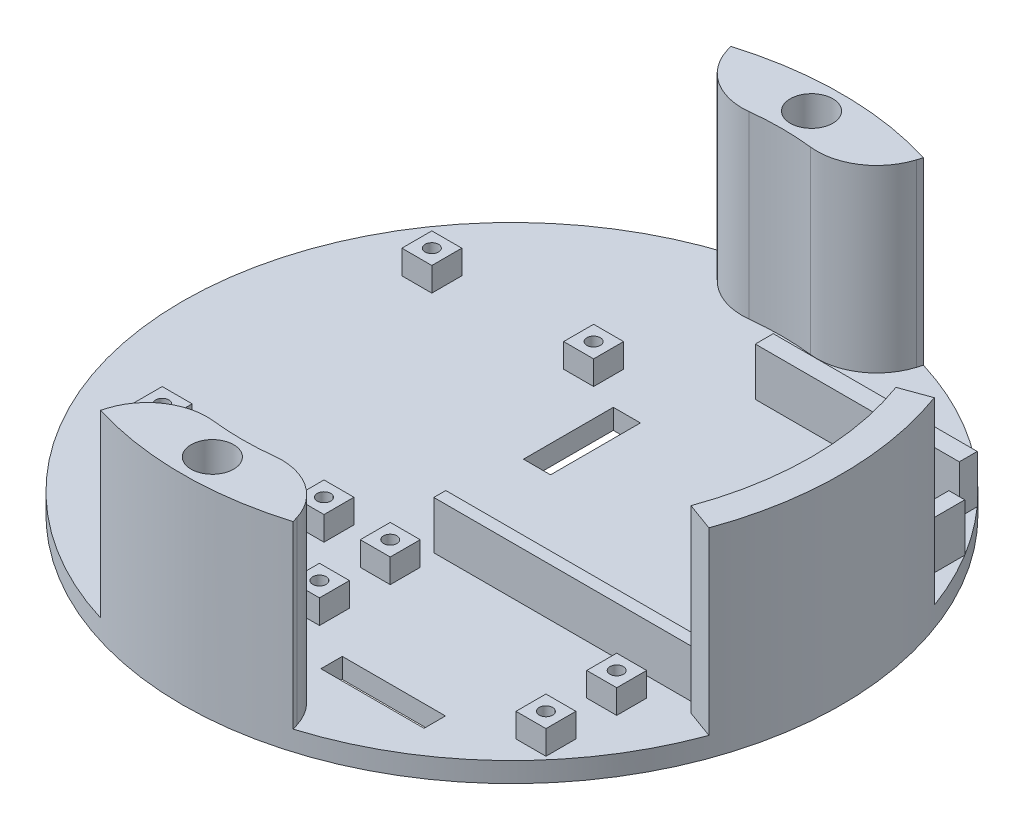
from build123d import *

# Parameters (mm, degrees)
SKETCH2_R               = 69.85
BOSS_EXTRUDE1_DEPTH     = 4.233333
BOSS_EXTRUDE2_DEPTH     = 38.1
FILLET3_R               = 12.7
FILLET4_R               = 12.7
FILLET5_R               = 12.7
BOSS_EXTRUDE3_DEPTH     = 38.1
CUT_EXTRUDE1_DEPTH      = 108.471653
CUT_EXTRUDE1_DEPTH_BACK = 108.471653
SKETCH5_R               = 4.5085
FILLET6_R               = 12.7
SKETCH6_W               = 43.23554
SKETCH6_H               = 3.81
BOSS_EXTRUDE4_DEPTH     = 10.16
SKETCH6_3_W             = 6.35
SKETCH6_3_H             = 6.35
SKETCH6_3_R             = 1.425
BOSS_EXTRUDE5_DEPTH     = 5.08
CUT_EXTRUDE2_DEPTH      = 105.155487
CUT_EXTRUDE2_DEPTH_BACK = 105.155487
SKETCH7_R               = 1.425
SKETCH7_W               = 21.869593
SKETCH7_H               = 4.532558
SKETCH7_W_2             = 5.739765
SKETCH7_H_2             = 19.05


with BuildPart() as part:
    # Sketch2 → Boss-Extrude1 (new body)
    with BuildSketch(Plane(origin=(0, 0, 0), x_dir=(1, 0, 0), z_dir=(0, 1, 0))):
        Circle(SKETCH2_R)
    extrude(amount=BOSS_EXTRUDE1_DEPTH)

    # Sketch3 → Boss-Extrude2 (add)
    with BuildSketch(Plane(origin=(0, 4.233333, 0), x_dir=(1, 0, 0), z_dir=(0, 1, 0))):
        with BuildLine():
            Line((-16.709043, -54.652817), (-20.422164, -66.797887))
            ThreePointArc((-20.422164, -66.797887), (0, -69.85), (20.422164, -66.797887))
            Line((20.422164, -66.797887), (16.709043, -54.652817))
            ThreePointArc((16.709043, -54.652817), (0, -57.15), (-16.709043, -54.652817))
        make_face()
        with BuildLine():
            ThreePointArc((20.422164, 66.797887), (0, 69.85), (-20.422164, 66.797887))
            Line((-20.422164, 66.797887), (-16.709043, 54.652817))
            ThreePointArc((-16.709043, 54.652817), (0, 57.15), (16.709043, 54.652817))
            Line((16.709043, 54.652817), (20.422164, 66.797887))
        make_face()
    extrude(amount=BOSS_EXTRUDE2_DEPTH)

    # Fillet3
    fillet3_edges = [part.edges().sort_by_distance(p)[0] for p in [
        (-16.709043, 23.283333, -54.652817),
    ]]
    fillet(fillet3_edges, radius=FILLET3_R)

    # Fillet4
    fillet4_edges = [part.edges().sort_by_distance(p)[0] for p in [
        (16.709043, 23.283333, 54.652817),
    ]]
    fillet(fillet4_edges, radius=FILLET4_R)

    # Fillet5
    fillet5_edges = [part.edges().sort_by_distance(p)[0] for p in [
        (-16.709043, 23.283333, 54.652817),
    ]]
    fillet(fillet5_edges, radius=FILLET5_R)

    # Sketch4 → Boss-Extrude3 (add)
    with BuildSketch(Plane(origin=(0, 4.233333, 0), x_dir=(1, 0, 0), z_dir=(0, 1, 0))):
        with BuildLine():
            Line((59.670481, 21.718279), (65.63753, 23.890107))
            ThreePointArc((65.63753, 23.890107), (69.85, 0), (65.63753, -23.890107))
            Line((65.63753, -23.890107), (59.670481, -21.718279))
            ThreePointArc((59.670481, -21.718279), (63.5, 0), (59.670481, 21.718279))
        make_face()
    extrude(amount=BOSS_EXTRUDE3_DEPTH)

    # Sketch5 → Cut-Extrude1 (cut, two sides: drawn at the far end of the back side and taken through both)
    with BuildSketch(Plane(origin=(0, 42.333333, 0), x_dir=(1, 0, 0), z_dir=(0, 1, 0)).offset(-CUT_EXTRUDE1_DEPTH_BACK)):
        with Locations((0, 63.5)):
            Circle(SKETCH5_R)
        with Locations((0, -63.5)):
            Circle(SKETCH5_R)
    extrude(amount=CUT_EXTRUDE1_DEPTH + CUT_EXTRUDE1_DEPTH_BACK, mode=Mode.SUBTRACT)

    # Fillet6
    fillet6_edges = [part.edges().sort_by_distance(p)[0] for p in [
        (16.709043, 23.283333, -54.652817),
    ]]
    fillet(fillet6_edges, radius=FILLET6_R)

    # Sketch6 → Boss-Extrude4 (add)
    with BuildSketch(Plane(origin=(0, 4.233333, 0), x_dir=(1, 0, 0), z_dir=(0, 1, 0))):
        with Locations((30.490655, 44.61096)):
            Rectangle(SKETCH6_W, SKETCH6_H)
        with BuildLine():
            Line((59.670481, 36.310551), (56.296076, 36.310551))
            Line((56.296076, 36.310551), (56.296076, -16.984045))
            Line((56.296076, -16.984045), (2.956076, -16.984045))
            Line((2.956076, -16.984045), (2.956076, -19.524045))
            Line((2.956076, -19.524045), (60.424016, -19.524045))
            ThreePointArc((60.424016, -19.524045), (63.489404, 1.160008), (59.670481, 21.718279))
            Line((59.670481, 21.718279), (59.670481, 36.310551))
        make_face()
    extrude(amount=BOSS_EXTRUDE4_DEPTH)

    # Sketch6<3> → Boss-Extrude5 (add)
    # profile 1 of 8: a face of its own
    with BuildSketch(Plane(origin=(0, 4.233333, 0), x_dir=(1, 0, 0), z_dir=(0, 1, 0))):
        with Locations((-13.796995, 31.103419)):
            Rectangle(SKETCH6_3_W, SKETCH6_3_H)
        with Locations((-13.796995, 31.103419)):
            Circle(SKETCH6_3_R, mode=Mode.SUBTRACT)
    # profile 2 of 8: a face of its own
    with BuildSketch(Plane(origin=(0, 4.233333, 0), x_dir=(1, 0, 0), z_dir=(0, 1, 0))):
        with Locations((-48.086995, 31.103419)):
            Rectangle(SKETCH6_3_W, SKETCH6_3_H)
        with Locations((-48.086995, 31.103419)):
            Circle(SKETCH6_3_R, mode=Mode.SUBTRACT)
    # profile 3 of 8: a face of its own
    with BuildSketch(Plane(origin=(0, 4.233333, 0), x_dir=(1, 0, 0), z_dir=(0, 1, 0))):
        with Locations((-13.796995, -26.046581)):
            Rectangle(SKETCH6_3_W, SKETCH6_3_H)
        with Locations((-13.796995, -26.046581)):
            Circle(SKETCH6_3_R, mode=Mode.SUBTRACT)
    # profile 4 of 8: a face of its own
    with BuildSketch(Plane(origin=(0, 4.233333, 0), x_dir=(1, 0, 0), z_dir=(0, 1, 0))):
        with Locations((-48.086995, -26.046581)):
            Rectangle(SKETCH6_3_W, SKETCH6_3_H)
        with Locations((-48.086995, -26.046581)):
            Circle(SKETCH6_3_R, mode=Mode.SUBTRACT)
    # profile 5 of 8: a face of its own
    with BuildSketch(Plane(origin=(0, 4.233333, 0), x_dir=(1, 0, 0), z_dir=(0, 1, 0))):
        with Locations((49.020141, -26.819212)):
            Rectangle(SKETCH6_3_W, SKETCH6_3_H)
        with Locations((49.020141, -26.819212)):
            Circle(SKETCH6_3_R, mode=Mode.SUBTRACT)
    # profile 6 of 8: a face of its own
    with BuildSketch(Plane(origin=(0, 4.233333, 0), x_dir=(1, 0, 0), z_dir=(0, 1, 0))):
        with Locations((1.019221, -26.819212)):
            Rectangle(SKETCH6_3_W, SKETCH6_3_H)
        with Locations((1.019221, -26.819212)):
            Circle(SKETCH6_3_R, mode=Mode.SUBTRACT)
    # profile 7 of 8: a face of its own
    with BuildSketch(Plane(origin=(0, 4.233333, 0), x_dir=(1, 0, 0), z_dir=(0, 1, 0))):
        with Locations((1.019221, -41.820452)):
            Rectangle(SKETCH6_3_W, SKETCH6_3_H)
        with Locations((1.019221, -41.820452)):
            Circle(SKETCH6_3_R, mode=Mode.SUBTRACT)
    # profile 8 of 8: a face of its own
    with BuildSketch(Plane(origin=(0, 4.233333, 0), x_dir=(1, 0, 0), z_dir=(0, 1, 0))):
        with Locations((49.020141, -41.820452)):
            Rectangle(SKETCH6_3_W, SKETCH6_3_H)
        with Locations((49.020141, -41.820452)):
            Circle(SKETCH6_3_R, mode=Mode.SUBTRACT)
    extrude(amount=BOSS_EXTRUDE5_DEPTH)

    # Sketch7 → Cut-Extrude2 (cut, two sides: drawn at the far end of the back side and taken through both)
    with BuildSketch(Plane(origin=(0, 9.313333, 0), x_dir=(1, 0, 0), z_dir=(0, 1, 0)).offset(-CUT_EXTRUDE2_DEPTH_BACK)):
        with Locations((-48.086995, 31.103419)):
            Circle(SKETCH7_R)
        with Locations((-13.796995, 31.103419)):
            Circle(SKETCH7_R)
        with Locations((1.019221, -41.820452)):
            Circle(SKETCH7_R)
        with Locations((1.019221, -26.819212)):
            Circle(SKETCH7_R)
        with Locations((-13.796995, -26.046581)):
            Circle(SKETCH7_R)
        with Locations((-48.086995, -26.046581)):
            Circle(SKETCH7_R)
        with Locations((49.020141, -26.819212)):
            Circle(SKETCH7_R)
        with Locations((49.020141, -41.820452)):
            Circle(SKETCH7_R)
        with Locations((23.21135, -50.507403)):
            Rectangle(SKETCH7_W, SKETCH7_H)
        with Locations((-1.850656, 16.681146)):
            Rectangle(SKETCH7_W_2, SKETCH7_H_2)
    extrude(amount=CUT_EXTRUDE2_DEPTH + CUT_EXTRUDE2_DEPTH_BACK, mode=Mode.SUBTRACT)


solid = part.part
